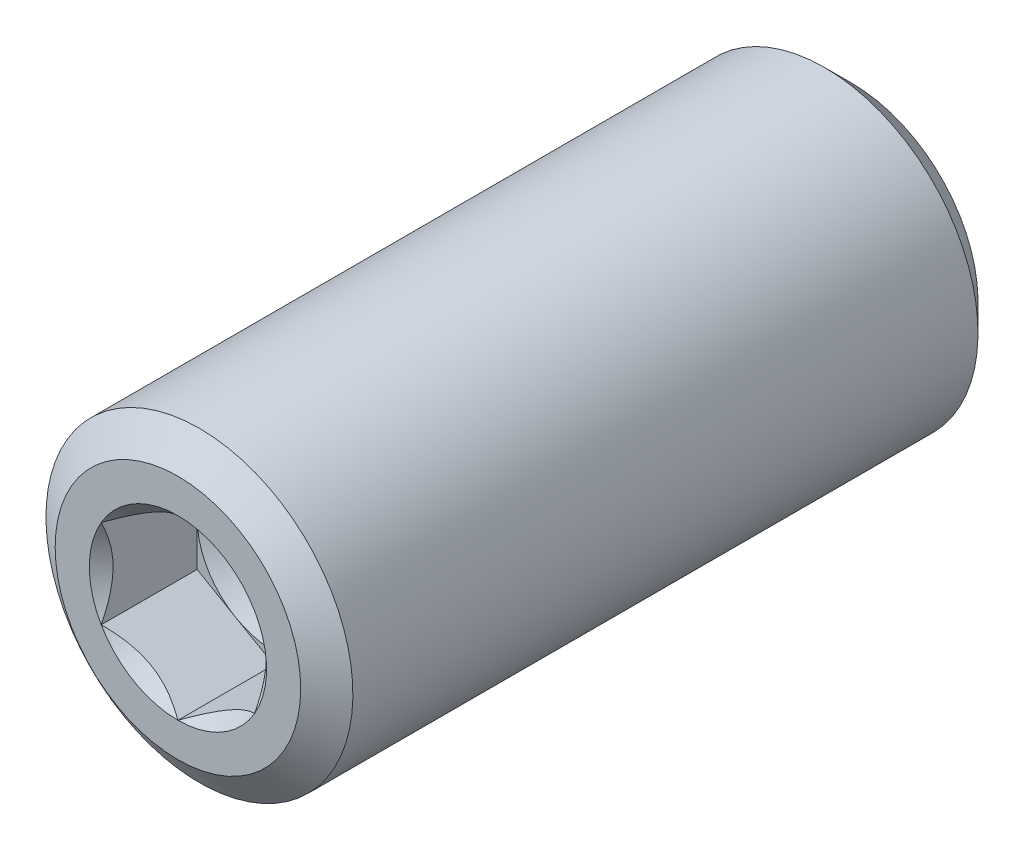
from build123d import *

# Parameters (mm, degrees)
CUT_EXTRUDE10_DEPTH = 1.5625
MOVE_FACE1_BY       = 0.05


with BuildPart() as part:
    # Sketch22 → Revolve1 (revolve)
    with BuildSketch(Plane(origin=(0, 0, 0), x_dir=(0, 0, -1), z_dir=(1, 0, 0))):
        with BuildLine():
            Line((-4.5, 0), (-4.5, 2))
            Line((-4.5, 2), (-4.149896231, 2.5))
            Line((-4.149896231, 2.5), (6.033115887, 2.5))
            Line((6.033115887, 2.5), (6.48, 2.053115887))
            Line((6.48, 2.053115887), (6.48, 1.421126314))
            ThreePointArc((6.48, 1.421126314), (5.125357216, 1.218605761), (4.5, 0))
            Line((4.5, 0), (-4.5, 0))
        make_face()
    revolve(axis=Axis((0, 0, -7.5), (0, 0, 1)))

    # Sketch23 → Cut-Extrude10 (cut)
    with BuildSketch(Plane.XY.offset(4.5)):
        Polygon((0, 1.443375673), (-1.25, 0.721687836), (-1.25, -0.721687836), (0, -1.443375673), (1.25, -0.721687836), (1.25, 0.721687836), align=None)
    extrude(amount=-CUT_EXTRUDE10_DEPTH, mode=Mode.SUBTRACT)

    # Cut-Extrude11 cone 1 section (through the dimple's axis) → Cut-Extrude11 (revolve, cut)
    with BuildSketch(Plane(origin=(0, 0, 4.5), x_dir=(0, -1, 0), z_dir=(1, 0, 0))):
        Polygon((0, 0), (1.443375673, 0), (0, 1.443375673), align=None)
    revolve(axis=Axis((0, 0, 4.5), (0, 0, -1)), mode=Mode.SUBTRACT)

    # Cut-Extrude12 cone 1 section (through the dimple's axis) → Cut-Extrude12 (revolve, cut)
    with BuildSketch(Plane(origin=(0, 0, 2.9375), x_dir=(0, -1, 0), z_dir=(1, 0, 0))):
        Polygon((0, 0), (1.25, 0), (0, 0.721687836), align=None)
    revolve(axis=Axis((0, 0, 2.9375), (0, 0, -1)), mode=Mode.SUBTRACT)

    # Move Face1: a curved face moved inward by 0.05
    add(Solid.thicken(part.faces().sort_by_distance((0, -1.218605761, -5.125357216))[0], -MOVE_FACE1_BY), mode=Mode.SUBTRACT)


with BuildPart() as body_2:
    # Sketch32 → Revolve2 (revolve)
    with BuildSketch(Plane(origin=(0, 0, 0), x_dir=(0, 0, -1), z_dir=(1, 0, 0))):
        with BuildLine():
            Line((7.5, 0), (4.5, 0))
            ThreePointArc((4.5, 0), (6, 1.5), (7.5, 0))
        make_face()
    revolve(axis=Axis((0, 0, -7.5), (0, 0, 1)))


solid = Compound([part.part, body_2.part])
